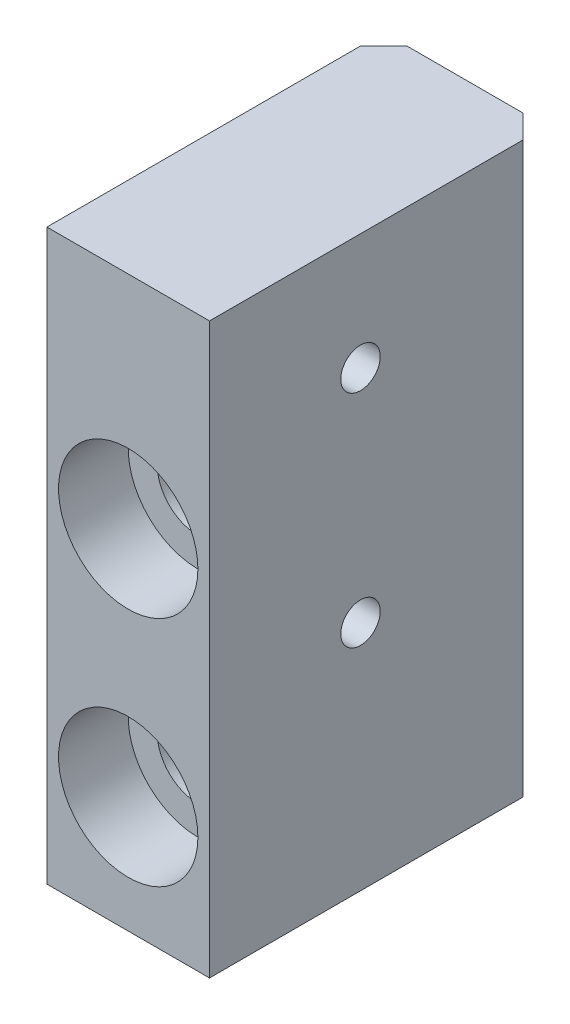
from build123d import *

# Parameters (mm, degrees)
SKETCH1_W           = 14.5
SKETCH1_H           = 24.5
SKETCH1_R           = 0.85
BOSS_EXTRUDE1_DEPTH = 7
CHAMFER1_SIZE       = 1
SKETCH2_R           = 1.75
CUT_EXTRUDE1_DEPTH  = 22.836036728
SKETCH3_R           = 3
CUT_EXTRUDE2_DEPTH  = 3


with BuildPart() as part:
    # Sketch1 → Boss-Extrude1 (new body)
    with BuildSketch(Plane(origin=(0, 0, 0), x_dir=(0, 0, -1), z_dir=(1, 0, 0))):
        with Locations((0.75, -2.5)):
            Rectangle(SKETCH1_W, SKETCH1_H)
        with Locations((0, 4.75)):
            Circle(SKETCH1_R, mode=Mode.SUBTRACT)
        with Locations((0, -4.75)):
            Circle(SKETCH1_R, mode=Mode.SUBTRACT)
    extrude(amount=BOSS_EXTRUDE1_DEPTH)

    # Chamfer1
    chamfer1_edges = [part.edges().sort_by_distance(p)[0] for p in [
        (7, -2.5, -8),
        (0, -2.5, -8),
    ]]
    chamfer(chamfer1_edges, length=CHAMFER1_SIZE)

    # Sketch2 → Cut-Extrude1 (cut, through all)
    with BuildSketch(Plane.XY.offset(6.5)):
        with Locations((3.5, 0.25)):
            Circle(SKETCH2_R)
        with Locations((3.5, -9.75)):
            Circle(SKETCH2_R)
    extrude(amount=-CUT_EXTRUDE1_DEPTH, mode=Mode.SUBTRACT)

    # Sketch3 → Cut-Extrude2 (cut)
    with BuildSketch(Plane.XY.offset(6.5)):
        with Locations((3.5, 0.25)):
            Circle(SKETCH3_R)
        with Locations((3.5, -9.75)):
            Circle(SKETCH3_R)
    extrude(amount=-CUT_EXTRUDE2_DEPTH, mode=Mode.SUBTRACT)


solid = part.part
